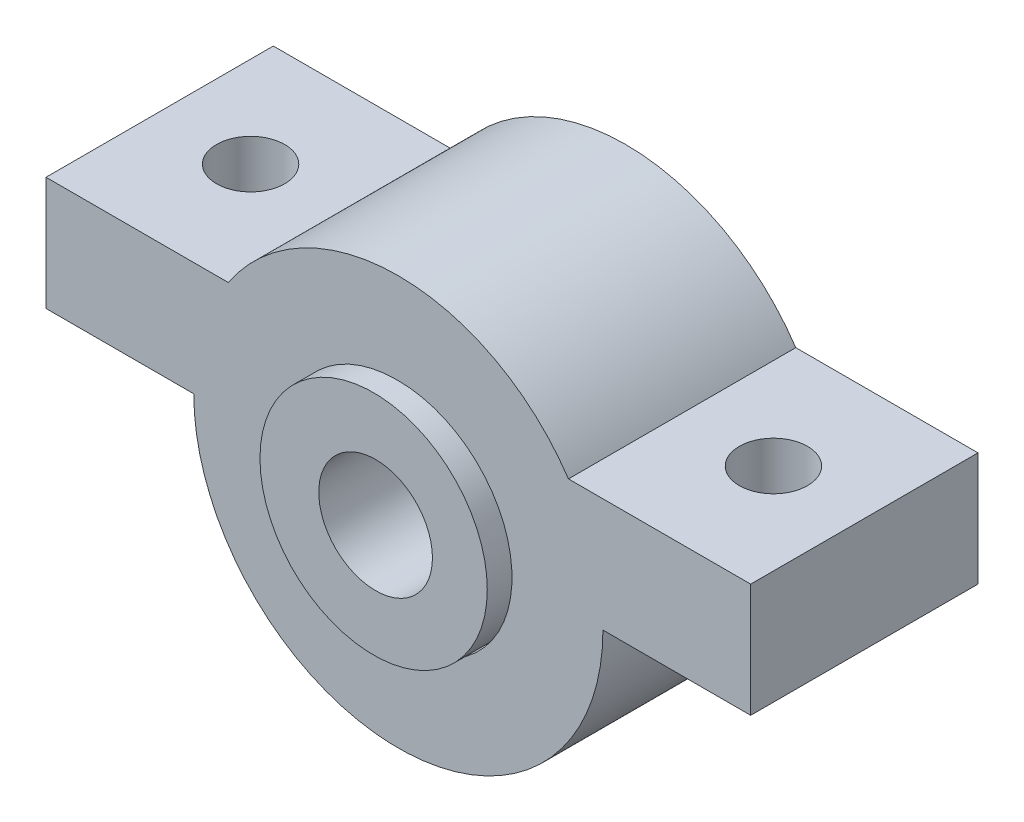
from build123d import *

# Parameters (mm, degrees)
SKETCH1_R                = 0.9
SKETCH1_R_2              = 0.5
SKETCH1_W                = 1
SKETCH1_H                = 0.5
BOSS_EXTRUDE1_DEPTH      = 1
BOSS_EXTRUDE2_DEPTH      = 11
BOSS_EXTRUDE2_DEPTH_BACK = 1.2
SKETCH2_R                = 0.5
SKETCH2_R_2              = 0.25
SKETCH3_R                = 0.66091417
CUT_EXTRUDE3_DEPTH       = 0.1
SKETCH4_R                = 0.55
CUT_EXTRUDE4_DEPTH       = 10.9
SKETCH5_R                = 0.15
CUT_EXTRUDE5_DEPTH       = 10.9
SCALE1_SCALE             = 10


with BuildPart() as part:
    # Sketch1 → Boss-Extrude1 (new body)
    # profile 1 of 3: a face of its own
    with BuildSketch(Plane.XY):
        Circle(SKETCH1_R)
        Circle(SKETCH1_R_2, mode=Mode.SUBTRACT)
    # profile 2 of 3: a face of its own
    with BuildSketch(Plane.XY):
        with Locations((1.05, 0.25)):
            Rectangle(SKETCH1_W, SKETCH1_H)
    # profile 3 of 3: a face of its own
    with BuildSketch(Plane.XY):
        with Locations((-1.05, 0.25)):
            Rectangle(SKETCH1_W, SKETCH1_H)
    extrude(amount=BOSS_EXTRUDE1_DEPTH)

    # Sketch2 → Boss-Extrude2 (add, two sides: drawn at the far end of the back side and taken through both)
    with BuildSketch(Plane.XY.offset(1).offset(-BOSS_EXTRUDE2_DEPTH_BACK)):
        with Locations((-0.008750419, 0)):
            Circle(SKETCH2_R)
        Circle(SKETCH2_R_2, mode=Mode.SUBTRACT)
    extrude(amount=BOSS_EXTRUDE2_DEPTH + BOSS_EXTRUDE2_DEPTH_BACK)

    # Sketch3 → Cut-Extrude3 (cut)
    with BuildSketch(Plane(origin=(0, 0, -0.2), x_dir=(-1, 0, 0), z_dir=(0, 0, -1))):
        with Locations((0.008750419, 0)):
            Circle(SKETCH3_R)
    extrude(amount=-CUT_EXTRUDE3_DEPTH, mode=Mode.SUBTRACT)

    # Sketch4 → Cut-Extrude4 (cut)
    with BuildSketch(Plane.XY.offset(12)):
        Circle(SKETCH4_R)
    extrude(amount=-CUT_EXTRUDE4_DEPTH, mode=Mode.SUBTRACT)

    # Sketch5 → Cut-Extrude5 (cut)
    with BuildSketch(Plane(origin=(0, 0.5, 0), x_dir=(1, 0, 0), z_dir=(0, 1, 0))):
        with Locations(Location((1.15, -0.5, 0), (0, 0, 270))):
            Circle(SKETCH5_R)
        with Locations(Location((-1.15, -0.5, 0), (0, 0, 270))):
            Circle(SKETCH5_R)
    extrude(amount=-CUT_EXTRUDE5_DEPTH, mode=Mode.SUBTRACT)


with BuildPart() as part_1:
    # Scale1: scaled about (0, 0, 0)
    add(part.part.scale(SCALE1_SCALE))


solid = part_1.part
